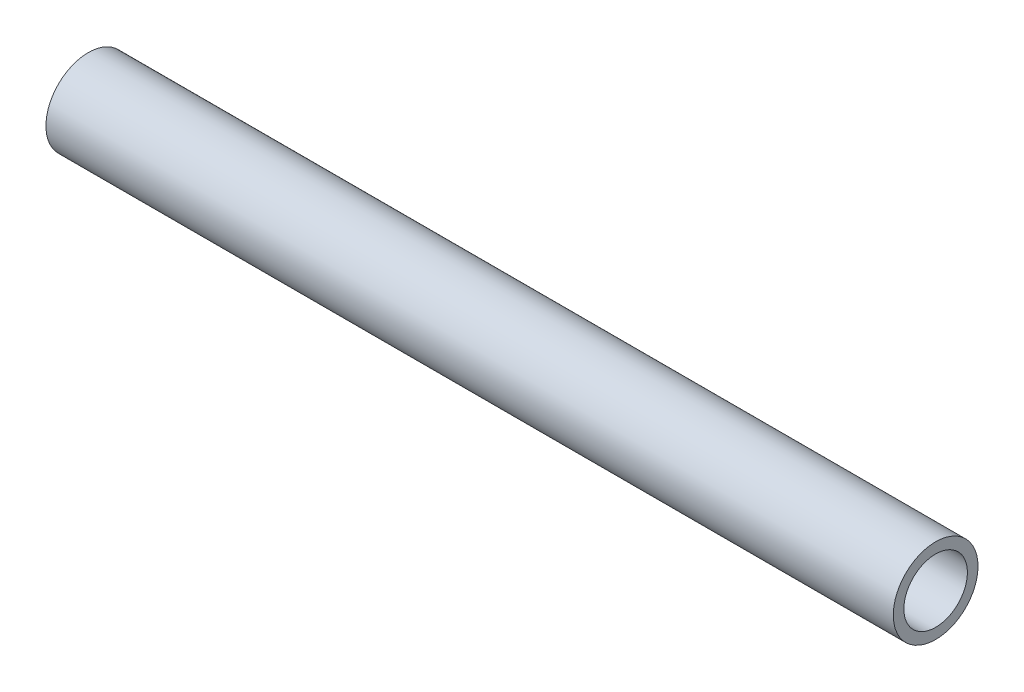
from build123d import *

# Parameters (mm, degrees)
SKETCH3_R           = 12.7
SKETCH3_R_2         = 9.525
BOSS_EXTRUDE1_DEPTH = 127


with BuildPart() as part:
    # Sketch3 → Boss-Extrude1 (new, symmetric)
    with BuildSketch(Plane(origin=(0, 0, 0), x_dir=(0, 0, -1), z_dir=(1, 0, 0))):
        Circle(SKETCH3_R)
        Circle(SKETCH3_R_2, mode=Mode.SUBTRACT)
    extrude(amount=BOSS_EXTRUDE1_DEPTH, both=True)


solid = part.part
